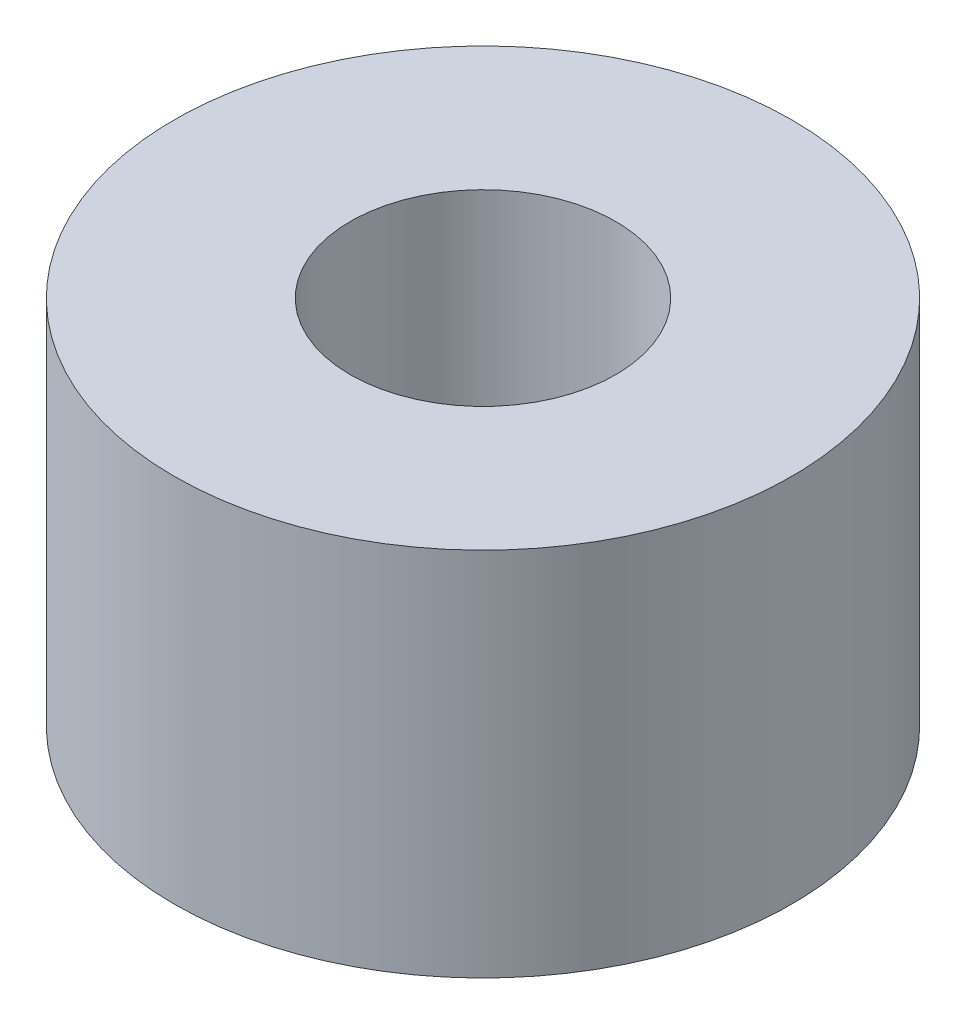
from build123d import *

# Parameters (mm, degrees)
SKETCH_1_W       = 10
SKETCH_1_H       = 12
SKETCH_2_R       = 4.3
AXIAL_BORE_DEPTH = 19.547236991


with BuildPart() as part:
    # 草图1 → Round_pushrod_head (revolve)
    with BuildSketch(Plane.XY, mode=Mode.PRIVATE) as round_pushrod_head_sk:
        with Locations((5, 6)):
            Rectangle(SKETCH_1_W, SKETCH_1_H)
    revolve(round_pushrod_head_sk.sketch.rotate(Axis((0, 0, 0), (0, 1, 0)), 90), axis=Axis((0, 0, 0), (0, 1, 0)))

    # 草图2 → Axial_bore (cut, through all)
    with BuildSketch(Plane(origin=(0, 12, 0), x_dir=(1, 0, 0), z_dir=(0, 1, 0))):
        with Locations(Location((0, 0, 0), (0, 0, 270))):
            Circle(SKETCH_2_R)
    extrude(amount=-AXIAL_BORE_DEPTH, mode=Mode.SUBTRACT)


solid = part.part
